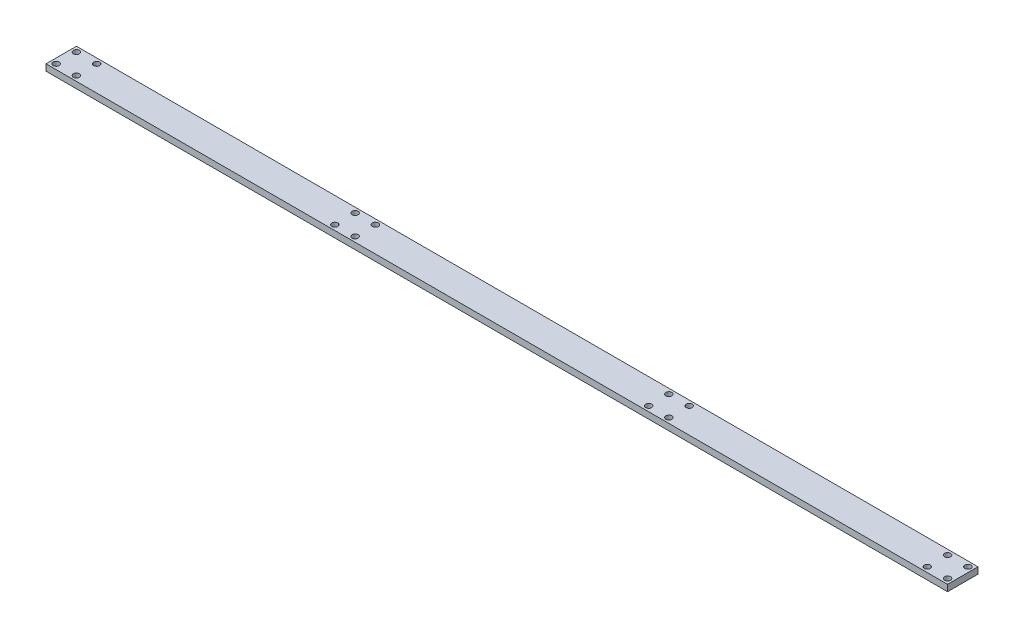
from build123d import *

# Parameters (mm, degrees)
SKETCH1_R           = 1.5
BOSS_EXTRUDE1_DEPTH = 3.175


with BuildPart() as part:
    # Sketch1 → Boss-Extrude1 (new body)
    with BuildSketch(Plane(origin=(0, 0, 0), x_dir=(1, 0, 0), z_dir=(0, 1, 0))):
        Polygon((0, 7.5), (0, 0), (444.5, 0), (444.5, 15), (0, 15), align=None)
        with Locations(Location((2.5, 2.5, 0), (0, 0, 270))):
            Circle(SKETCH1_R, mode=Mode.SUBTRACT)
        with Locations(Location((12.5, 2.5, 0), (0, 0, 270))):
            Circle(SKETCH1_R, mode=Mode.SUBTRACT)
        with Locations(Location((139.9, 2.5, 0), (0, 0, 270))):
            Circle(SKETCH1_R, mode=Mode.SUBTRACT)
        with Locations(Location((149.9, 2.5, 0), (0, 0, 270))):
            Circle(SKETCH1_R, mode=Mode.SUBTRACT)
        with Locations(Location((2.5, 12.5, 0), (0, 0, 270))):
            Circle(SKETCH1_R, mode=Mode.SUBTRACT)
        with Locations(Location((12.5, 12.5, 0), (0, 0, 270))):
            Circle(SKETCH1_R, mode=Mode.SUBTRACT)
        with Locations(Location((139.9, 12.5, 0), (0, 0, 270))):
            Circle(SKETCH1_R, mode=Mode.SUBTRACT)
        with Locations(Location((149.9, 12.5, 0), (0, 0, 270))):
            Circle(SKETCH1_R, mode=Mode.SUBTRACT)
        with Locations(Location((442, 12.5, 0), (0, 0, 270))):
            Circle(SKETCH1_R, mode=Mode.SUBTRACT)
        with Locations(Location((294.6, 2.5, 0), (0, 0, 270))):
            Circle(SKETCH1_R, mode=Mode.SUBTRACT)
        with Locations(Location((304.6, 2.5, 0), (0, 0, 270))):
            Circle(SKETCH1_R, mode=Mode.SUBTRACT)
        with Locations(Location((432, 2.5, 0), (0, 0, 270))):
            Circle(SKETCH1_R, mode=Mode.SUBTRACT)
        with Locations(Location((442, 2.5, 0), (0, 0, 270))):
            Circle(SKETCH1_R, mode=Mode.SUBTRACT)
        with Locations(Location((294.6, 12.5, 0), (0, 0, 270))):
            Circle(SKETCH1_R, mode=Mode.SUBTRACT)
        with Locations(Location((304.6, 12.5, 0), (0, 0, 270))):
            Circle(SKETCH1_R, mode=Mode.SUBTRACT)
        with Locations(Location((432, 12.5, 0), (0, 0, 270))):
            Circle(SKETCH1_R, mode=Mode.SUBTRACT)
    extrude(amount=BOSS_EXTRUDE1_DEPTH)


solid = part.part
